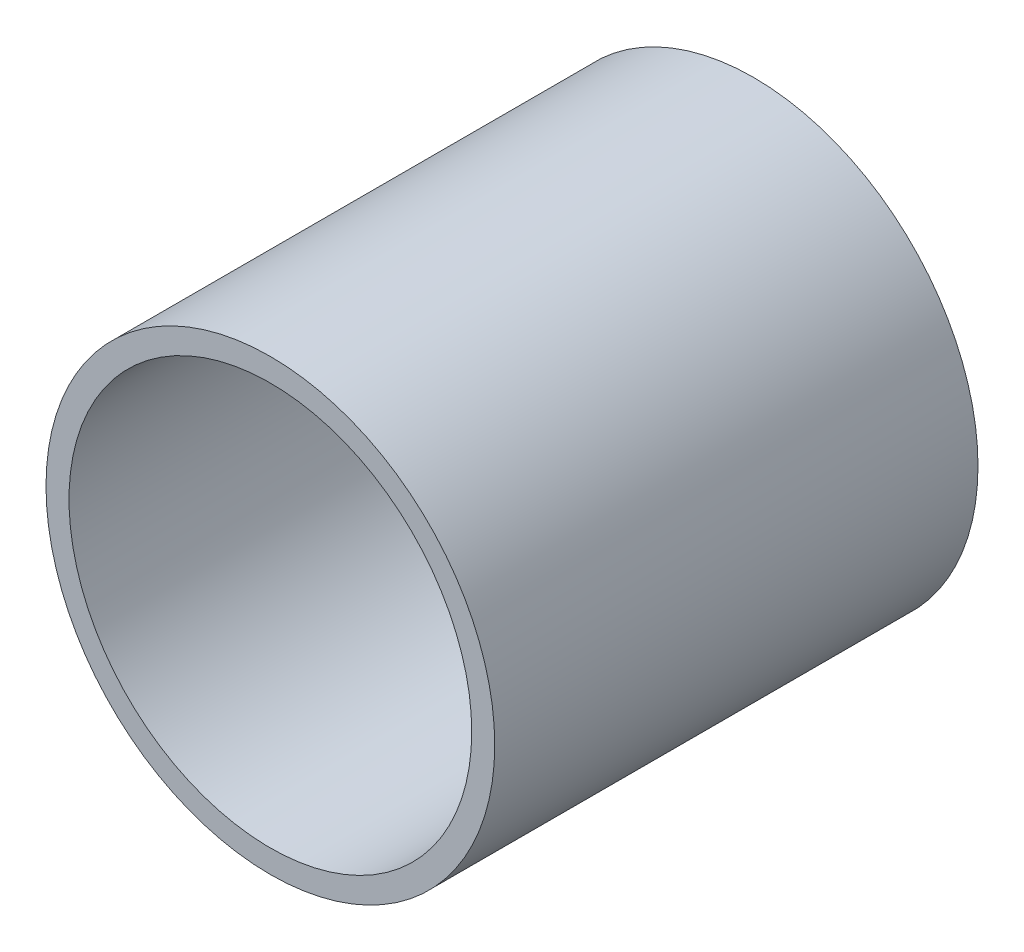
from build123d import *

# Parameters (mm, degrees)
SKETCH1_R           = 1.95
SKETCH1_R_2         = 1.75
BOSS_EXTRUDE1_DEPTH = 4.2


with BuildPart() as part:
    # Sketch1 → Boss-Extrude1 (new body)
    with BuildSketch(Plane.XY):
        Circle(SKETCH1_R)
        Circle(SKETCH1_R_2, mode=Mode.SUBTRACT)
    extrude(amount=BOSS_EXTRUDE1_DEPTH)


solid = part.part
